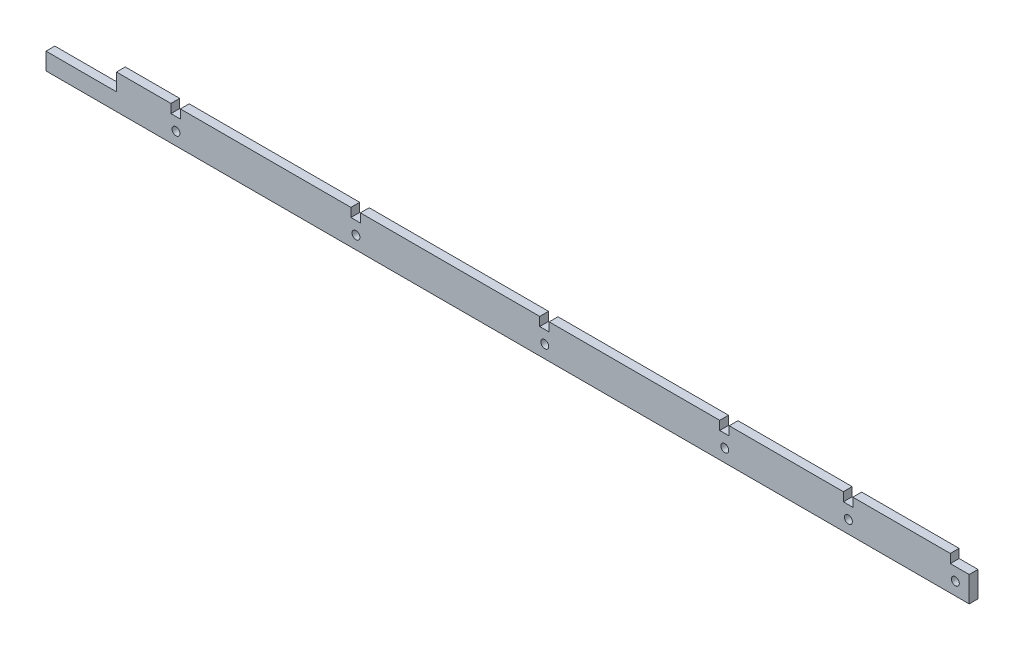
from build123d import *

# Parameters (mm, degrees)
SKETCH1_R           = 1.4224
BOSS_EXTRUDE1_DEPTH = 3.175


with BuildPart() as part:
    # Sketch1 → Boss-Extrude1 (new body)
    with BuildSketch(Plane.XY):
        Polygon((6235.604848961, 2712.383832202), (6235.604848961, 2715.558832202), (6200.459551877, 2715.558832202), (6200.459551877, 2712.383832202), (6197.055951877, 2712.383832202), (6197.055951877, 2715.558832202), (6155.893298961, 2715.558832202), (6155.893298961, 2712.383832202), (6152.489698961, 2712.383832202), (6152.489698961, 2715.558832202), (6091.008998961, 2715.558832202), (6091.008998961, 2712.383832202), (6087.605398961, 2712.383832202), (6087.605398961, 2715.558832202), (6022.949698961, 2715.558832202), (6022.949698961, 2712.383832202), (6019.546098961, 2712.383832202), (6019.546098961, 2715.558832202), (5958.065398961, 2715.558832202), (5958.065398961, 2712.383832202), (5954.661798961, 2712.383832202), (5954.661798961, 2715.558832202), (5935.033948961, 2715.558832202), (5935.033948961, 2709.373932202), (5909.633948961, 2709.373932202), (5909.633948961, 2703.189032202), (6242.412048961, 2703.189032202), (6242.412048961, 2712.383832202), align=None)
        with Locations((5956.477898961, 2707.786432202)):
            Circle(SKETCH1_R, mode=Mode.SUBTRACT)
        with Locations((6021.362198961, 2707.786432202)):
            Circle(SKETCH1_R, mode=Mode.SUBTRACT)
        with Locations((6089.421498961, 2707.786432202)):
            Circle(SKETCH1_R, mode=Mode.SUBTRACT)
        with Locations((6154.305798961, 2707.786432202)):
            Circle(SKETCH1_R, mode=Mode.SUBTRACT)
        with Locations((6198.872051877, 2707.786432202)):
            Circle(SKETCH1_R, mode=Mode.SUBTRACT)
        with Locations((6237.420948961, 2707.786432202)):
            Circle(SKETCH1_R, mode=Mode.SUBTRACT)
    extrude(amount=BOSS_EXTRUDE1_DEPTH)


solid = part.part
